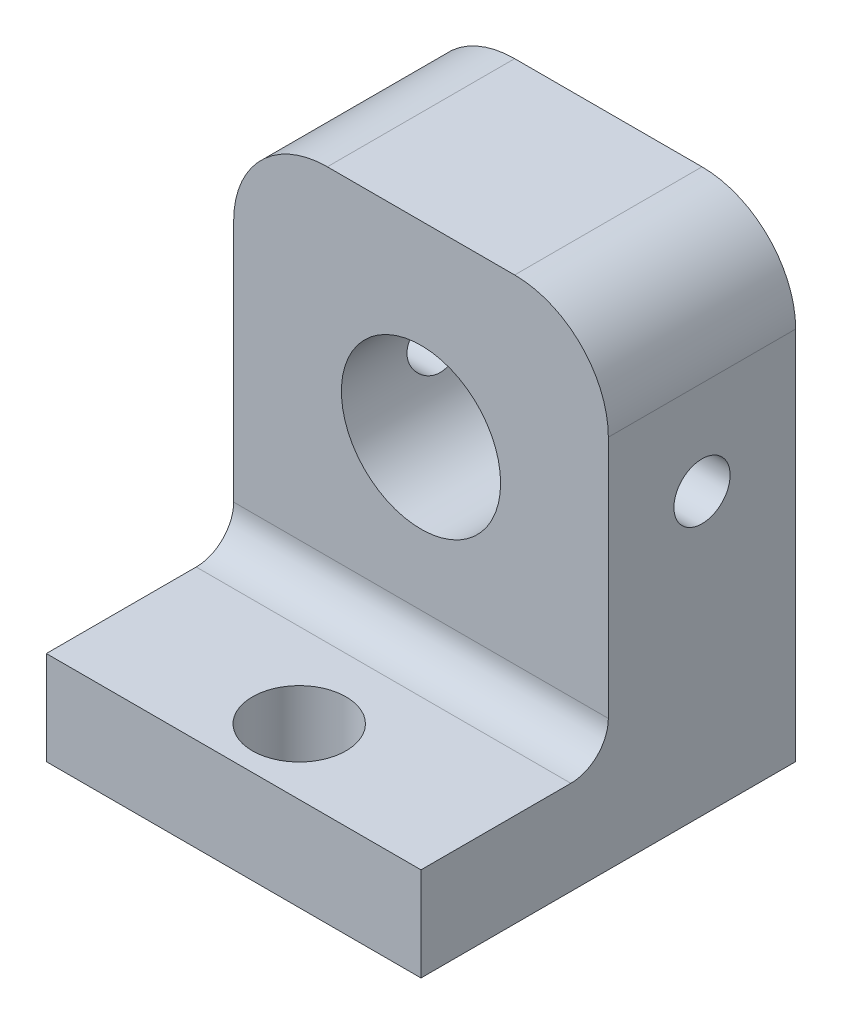
from build123d import *

# Parameters (mm, degrees)
SKETCH2_W           = 20
SKETCH2_H           = 20
SKETCH2_R           = 2.5
BOSS_EXTRUDE1_DEPTH = 5
SKETCH2_3_W         = 20
SKETCH2_3_H         = 10
BOSS_EXTRUDE2_DEPTH = 25
SKETCH4_R           = 4.25
CUT_EXTRUDE1_DEPTH  = 88
SKETCH5_R           = 1.5
CUT_EXTRUDE2_DEPTH  = 88
FILLET1_R           = 5
FILLET2_R           = 2


with BuildPart() as part:
    # Sketch2 → Boss-Extrude1 (new body)
    with BuildSketch(Plane(origin=(0, 0, 0), x_dir=(1, 0, 0), z_dir=(0, 1, 0))):
        Rectangle(SKETCH2_W, SKETCH2_H)
        with Locations((0, -6.5)):
            Circle(SKETCH2_R, mode=Mode.SUBTRACT)
    extrude(amount=BOSS_EXTRUDE1_DEPTH)

    # Sketch2<3> → Boss-Extrude2 (add)
    with BuildSketch(Plane(origin=(0, 0, 0), x_dir=(1, 0, 0), z_dir=(0, 1, 0))):
        with Locations((0, 5)):
            Rectangle(SKETCH2_3_W, SKETCH2_3_H)
    extrude(amount=BOSS_EXTRUDE2_DEPTH)

    # Sketch4 → Cut-Extrude1 (cut)
    with BuildSketch(Plane.XY):
        with Locations((0, 15)):
            Circle(SKETCH4_R)
    extrude(amount=-CUT_EXTRUDE1_DEPTH, mode=Mode.SUBTRACT)

    # Sketch5 → Cut-Extrude2 (cut)
    with BuildSketch(Plane(origin=(10, 0, 0), x_dir=(0, 0, -1), z_dir=(1, 0, 0))):
        with Locations((5, 15)):
            Circle(SKETCH5_R)
    extrude(amount=-CUT_EXTRUDE2_DEPTH, mode=Mode.SUBTRACT)

    # Fillet1
    fillet1_edges = [part.edges().sort_by_distance(p)[0] for p in [
        (-10, 25, -5),
        (10, 25, -5),
    ]]
    fillet(fillet1_edges, radius=FILLET1_R)

    # Fillet2
    fillet2_edges = [part.edges().sort_by_distance(p)[0] for p in [
        (0, 5, 0),
    ]]
    fillet(fillet2_edges, radius=FILLET2_R)


solid = part.part
